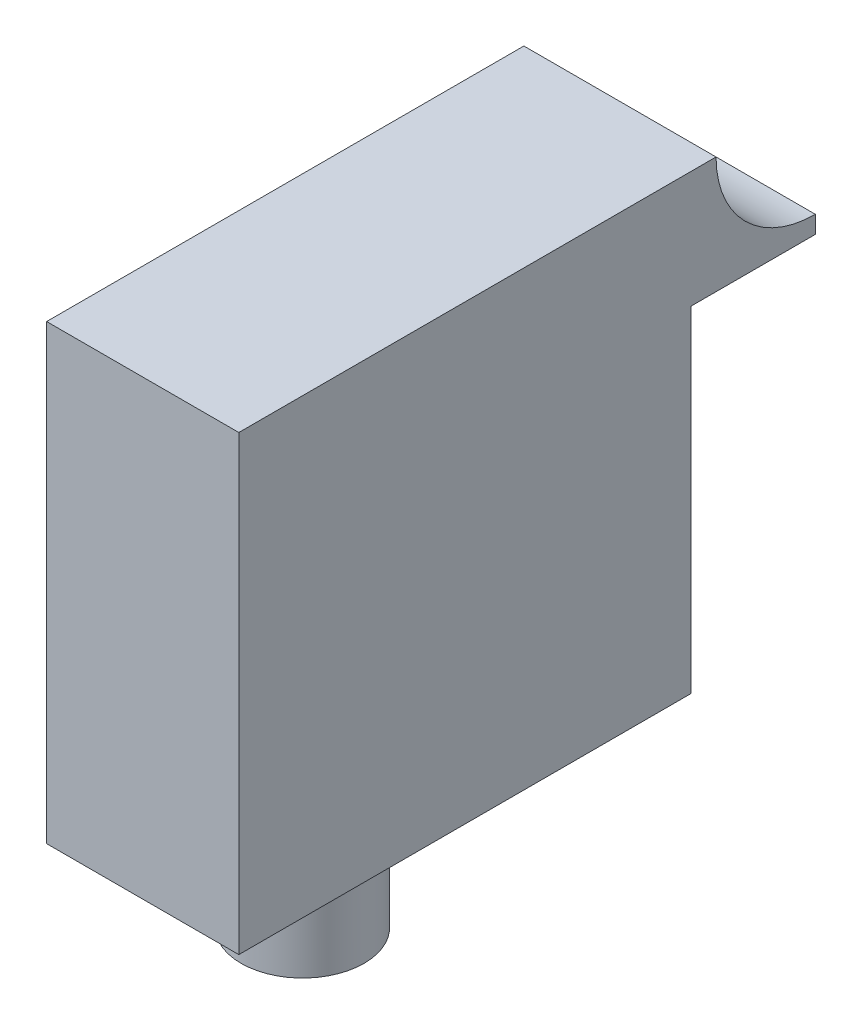
from build123d import *

# Parameters (mm, degrees)
SKETCH_1_W          = 40
SKETCH_1_H          = 40
EXTRUDE_1_DEPTH     = 17
SKETCH_2_W          = 39
SKETCH_2_H          = 39
EXTRUDE_2_DEPTH     = 11
SKETCH_3_W          = 2
SKETCH_3_H          = 39
CUT_EXTRUDE_1_DEPTH = 9
EXTRUDE_3_DEPTH     = 11
SKETCH_5_R          = 5.444681892
EXTRUDE_4_DEPTH     = 11
SKETCH_6_W          = 25
SKETCH_6_H          = 17.382728094
EXTRUDE_5_DEPTH     = 11
SKETCH_7_R          = 4.5
EXTRUDE_6_DEPTH     = 11
EXTRUDE_6_TAPER     = 17
SKETCH_8_W          = 17
SKETCH_8_H          = 10.324195756
EXTRUDE_7_DEPTH     = 11
SKETCH_9_R          = 8.784415214
CUT_EXTRUDE_2_DEPTH = 27
CUT_EXTRUDE_START   = 10
SKETCH_10_W         = 58.477636184
SKETCH_10_H         = 70.793077964
CUT_EXTRUDE_3_DEPTH = 47
SKETCH_11_W         = 62.750592471
SKETCH_11_H         = 80.218393182
CUT_EXTRUDE_4_DEPTH = 22


with BuildPart() as part:
    # Эскиз1 → Бобышка-Вытянуть1 (new body)
    with BuildSketch(Plane(origin=(0, 0, 0), x_dir=(0, 0, -1), z_dir=(1, 0, 0))):
        Rectangle(SKETCH_1_W, SKETCH_1_H)
    extrude(amount=EXTRUDE_1_DEPTH)

    # Эскиз2 → Бобышка-Вытянуть2 (add)
    with BuildSketch(Plane(origin=(17, 0, 0), x_dir=(0, 0, -1), z_dir=(1, 0, 0))):
        Rectangle(SKETCH_2_W, SKETCH_2_H)
    extrude(amount=EXTRUDE_2_DEPTH)

    # Эскиз3 → Вырез-Вытянуть1 (cut)
    with BuildSketch(Plane(origin=(28, 0, 0), x_dir=(0, 0, -1), z_dir=(1, 0, 0))):
        with Locations((-16, 0)):
            Rectangle(SKETCH_3_W, SKETCH_3_H)
        with Locations((-12, 0)):
            Rectangle(SKETCH_3_W, SKETCH_3_H)
        with Locations((-8, 0)):
            Rectangle(SKETCH_3_W, SKETCH_3_H)
        with Locations((-4, 0)):
            Rectangle(SKETCH_3_W, SKETCH_3_H)
        Rectangle(SKETCH_3_W, SKETCH_3_H)
        with Locations((4, 0)):
            Rectangle(SKETCH_3_W, SKETCH_3_H)
        with Locations((8, 0)):
            Rectangle(SKETCH_3_W, SKETCH_3_H)
        with Locations((12, 0)):
            Rectangle(SKETCH_3_W, SKETCH_3_H)
        with Locations((16, 0)):
            Rectangle(SKETCH_3_W, SKETCH_3_H)
    extrude(amount=-CUT_EXTRUDE_1_DEPTH, mode=Mode.SUBTRACT)

    # Эскиз4 → Бобышка-Вытянуть3 (add)
    with BuildSketch(Plane(origin=(28, 0, 0), x_dir=(0, 0, -1), z_dir=(1, 0, 0))):
        with BuildLine():
            Line((13.94108797, 18.534083609), (-13.965803425, 18.534083609))
            ThreePointArc((-13.965803425, 18.534083609), (-17.501337331, 17.069617515), (-18.965803425, 13.534083609))
            Line((-18.965803425, 13.534083609), (-18.965803425, -13.794341936))
            ThreePointArc((-18.965803425, -13.794341936), (-17.501337331, -17.329875842), (-13.965803425, -18.794341936))
            Line((-13.965803425, -18.794341936), (13.94108797, -18.794341936))
            ThreePointArc((13.94108797, -18.794341936), (17.476621876, -17.329875842), (18.94108797, -13.794341936))
            Line((18.94108797, -13.794341936), (18.94108797, 13.534083609))
            ThreePointArc((18.94108797, 13.534083609), (17.476621876, 17.069617515), (13.94108797, 18.534083609))
        make_face()
    extrude(amount=EXTRUDE_3_DEPTH)

    # Эскиз5 → Бобышка-Вытянуть4 (add)
    with BuildSketch(Plane.XZ.offset(20)):
        with Locations(Location((7.767128211, 5.128320155, 0), (0, 0, 90))):
            Circle(SKETCH_5_R)
    extrude(amount=EXTRUDE_4_DEPTH)

    # Эскиз6 → Бобышка-Вытянуть5 (add)
    with BuildSketch(Plane.XZ.offset(31)):
        with Locations((10.668319864, 5.154067921)):
            Rectangle(SKETCH_6_W, SKETCH_6_H)
    extrude(amount=EXTRUDE_5_DEPTH)

    # Эскиз7 → Бобышка-Вытянуть6 (add)
    with BuildSketch(Plane.XZ.offset(42)):
        with Locations((7.710138854, 5.107455984)):
            Circle(SKETCH_7_R)
    extrude(amount=EXTRUDE_6_DEPTH, taper=EXTRUDE_6_TAPER)

    # Эскиз8 → Бобышка-Вытянуть7 (add)
    with BuildSketch(Plane(origin=(0, 0, -20), x_dir=(-1, 0, 0), z_dir=(0, 0, -1))):
        with Locations((-8.5, 14.837902122)):
            Rectangle(SKETCH_8_W, SKETCH_8_H)
    extrude(amount=EXTRUDE_7_DEPTH)

    # Эскиз9 → Вырез-Вытянуть2 (cut)
    with BuildSketch(Plane(origin=(17, 0, 0), x_dir=(0, 0, -1), z_dir=(1, 0, 0))):
        with Locations((31, 20)):
            Circle(SKETCH_9_R)
    extrude(amount=-CUT_EXTRUDE_2_DEPTH, mode=Mode.SUBTRACT)

    # Эскиз10 → Вырез-Вытянуть3 (cut)
    with BuildSketch(Plane.XZ.offset(20).offset(CUT_EXTRUDE_START)):
        with Locations((4.776161953, -4.159448177)):
            Rectangle(SKETCH_10_W, SKETCH_10_H)
    extrude(amount=CUT_EXTRUDE_3_DEPTH, mode=Mode.SUBTRACT)

    # Эскиз11 → Вырез-Вытянуть4 (cut)
    with BuildSketch(Plane(origin=(39, 0, 0), x_dir=(0, 0, -1), z_dir=(1, 0, 0))):
        with Locations((5.568785854, 6.666933577)):
            Rectangle(SKETCH_11_W, SKETCH_11_H)
    extrude(amount=-CUT_EXTRUDE_4_DEPTH, mode=Mode.SUBTRACT)


solid = part.part
